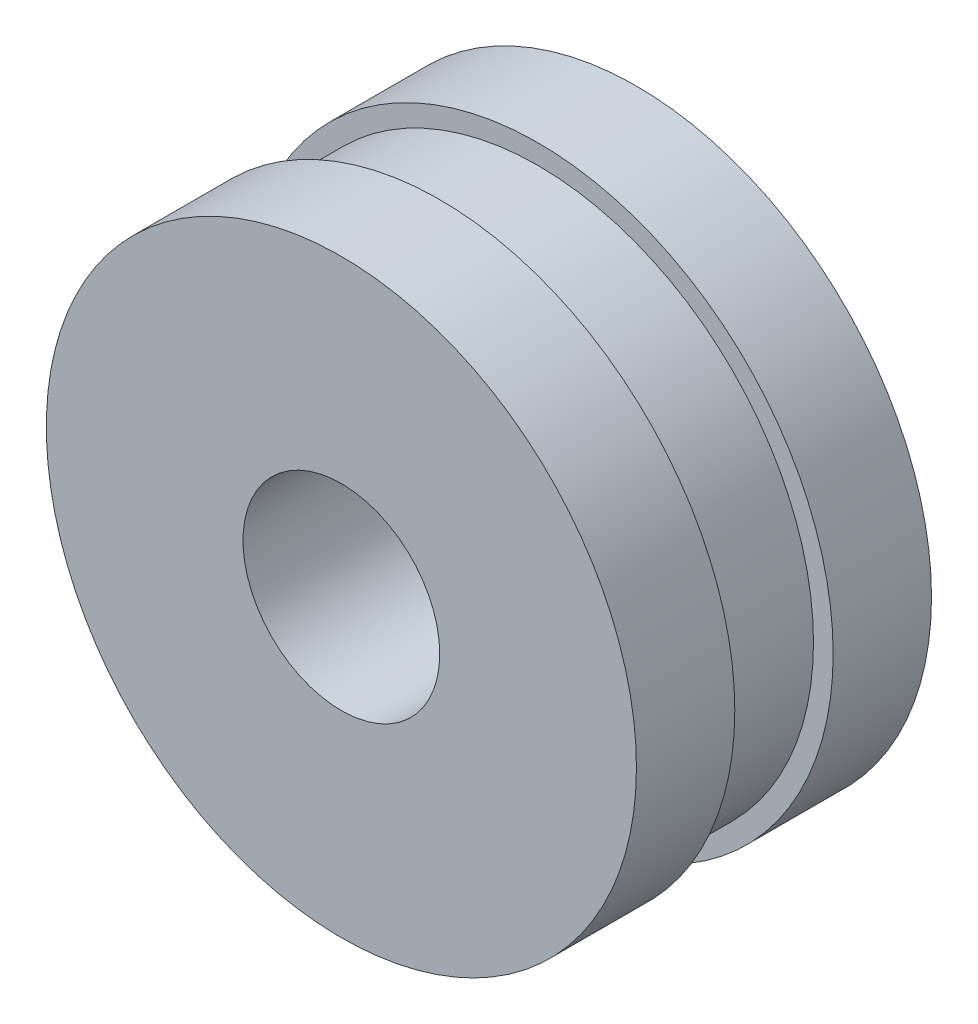
from build123d import *

# Parameters (mm, degrees)
EXTRUDE_1_DEPTH          = 1.5
EXTRUDE_1_DEPTH_BACK     = 1.5
SKETCH_1_R               = 3
SKETCH_1_R_2             = 1
CUT_EXTRUDE_1_DEPTH      = 0.5
CUT_EXTRUDE_1_DEPTH_BACK = 0.5
SKETCH_2_R               = 3
SKETCH_2_R_2             = 2.8


with BuildPart() as part:
    # 草图1 → 凸台-拉伸1 (new, two sides: drawn at the far end of the back side and taken through both)
    with BuildSketch(Plane.XY.offset(-EXTRUDE_1_DEPTH_BACK)):
        Circle(SKETCH_1_R)
        Circle(SKETCH_1_R_2, mode=Mode.SUBTRACT)
    extrude(amount=EXTRUDE_1_DEPTH + EXTRUDE_1_DEPTH_BACK)

    # 草图2 → 切除-拉伸1 (cut, two sides: drawn at the far end of the back side and taken through both)
    with BuildSketch(Plane.XY.offset(-CUT_EXTRUDE_1_DEPTH_BACK)):
        Circle(SKETCH_2_R)
        Circle(SKETCH_2_R_2, mode=Mode.SUBTRACT)
    extrude(amount=CUT_EXTRUDE_1_DEPTH + CUT_EXTRUDE_1_DEPTH_BACK, mode=Mode.SUBTRACT)


solid = part.part
